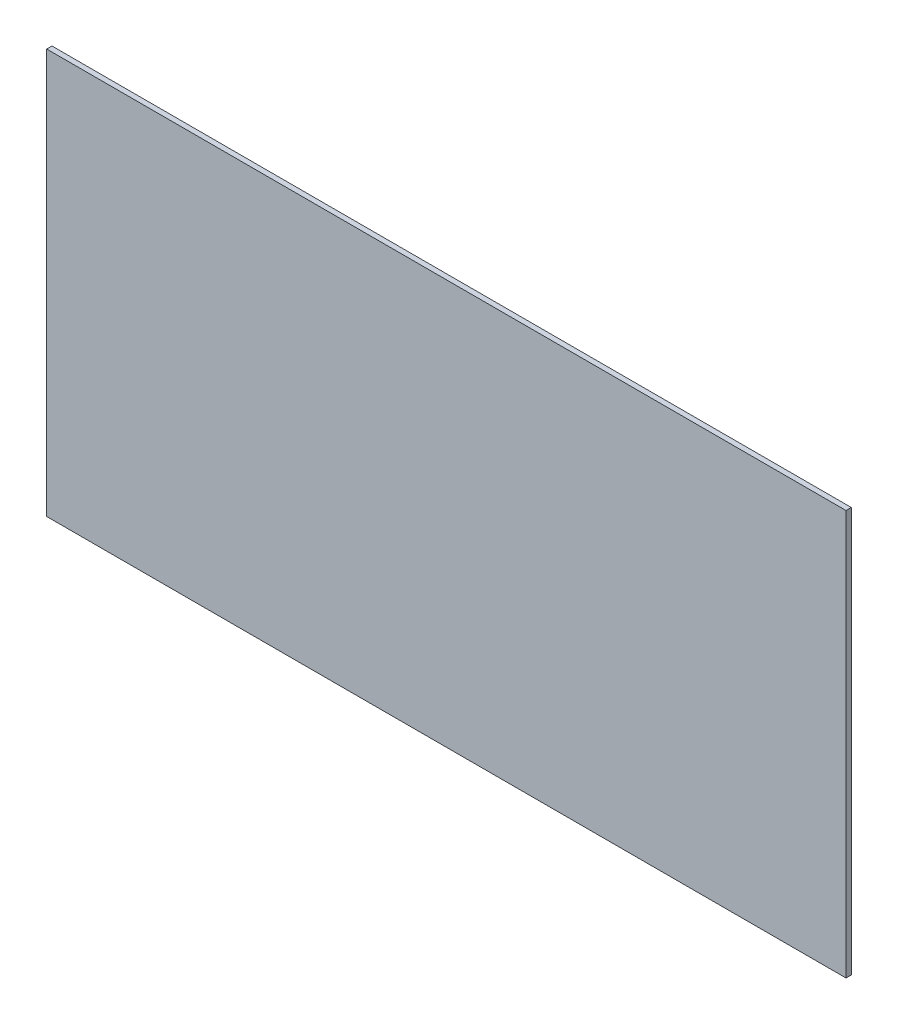
from build123d import *

# Parameters (mm, degrees)
SKETCH_1_W      = 1520
SKETCH_1_H      = 770
EXTRUDE_1_DEPTH = 10


with BuildPart() as part:
    # Эскиз1 → Бобышка-Вытянуть1 (new body)
    with BuildSketch(Plane.XY):
        with Locations((760, 385)):
            Rectangle(SKETCH_1_W, SKETCH_1_H)
    extrude(amount=EXTRUDE_1_DEPTH)


solid = part.part
